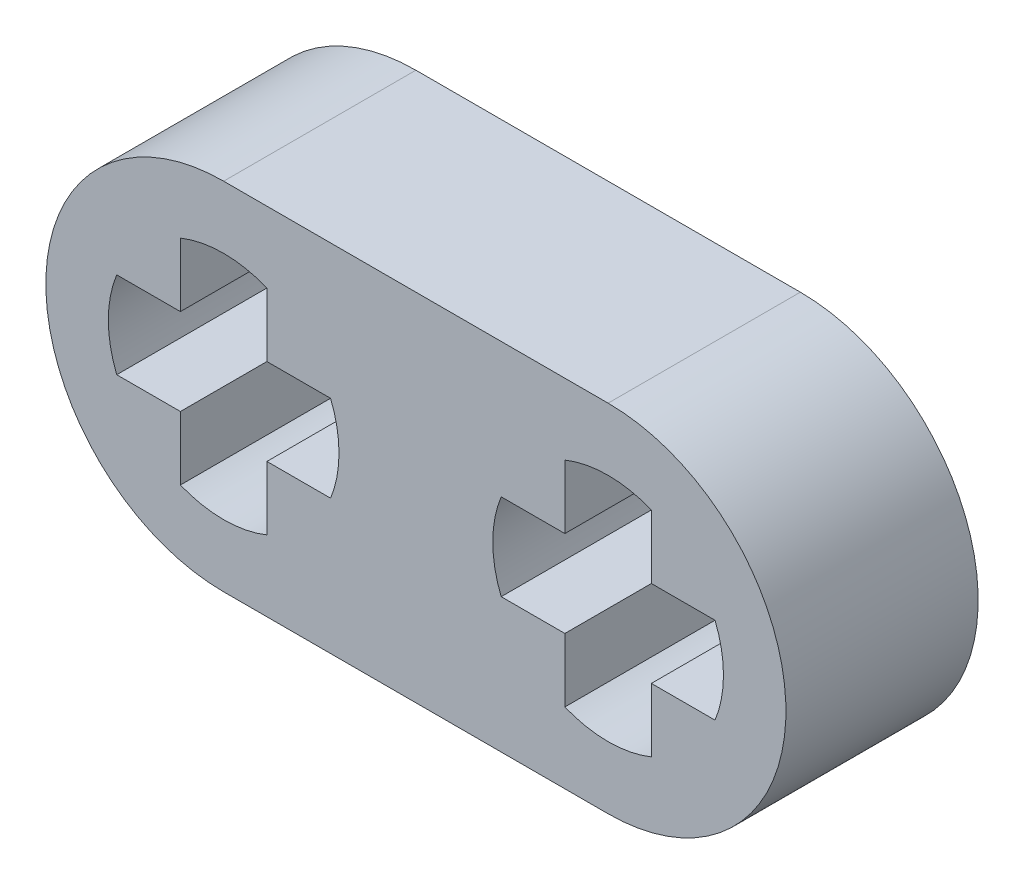
from build123d import *

# Parameters (mm, degrees)
BOSS_EXTRUDE1_DEPTH = 2


with BuildPart() as part:
    # Sketch1 → Boss-Extrude1 (new, symmetric)
    with BuildSketch(Plane.XY):
        with BuildLine():
            Line((-4, -3.7), (4, -3.7))
            ThreePointArc((4, -3.7), (7.7, 0), (4, 3.7))
            Line((4, 3.7), (-4, 3.7))
            ThreePointArc((-4, 3.7), (-7.7, 0), (-4, -3.7))
        make_face()
        with BuildLine():
            Line((-3.1, 2.224859546), (-3.1, 0.9))
            Line((-3.1, 0.9), (-1.775140454, 0.9))
            ThreePointArc((-1.775140454, 0.9), (-1.6, 0), (-1.775140454, -0.9))
            Line((-1.775140454, -0.9), (-3.1, -0.9))
            Line((-3.1, -0.9), (-3.1, -2.224859546))
            ThreePointArc((-3.1, -2.224859546), (-4, -2.4), (-4.9, -2.224859546))
            Line((-4.9, -2.224859546), (-4.9, -0.9))
            Line((-4.9, -0.9), (-6.224859546, -0.9))
            ThreePointArc((-6.224859546, -0.9), (-6.4, 0), (-6.224859546, 0.9))
            Line((-6.224859546, 0.9), (-4.9, 0.9))
            Line((-4.9, 0.9), (-4.9, 2.224859546))
            ThreePointArc((-4.9, 2.224859546), (-4, 2.4), (-3.1, 2.224859546))
        make_face(mode=Mode.SUBTRACT)
        with BuildLine():
            ThreePointArc((4.9, -2.224859546), (4, -2.4), (3.1, -2.224859546))
            Line((3.1, -2.224859546), (3.1, -0.9))
            Line((3.1, -0.9), (1.775140454, -0.9))
            ThreePointArc((1.775140454, -0.9), (1.6, 0), (1.775140454, 0.9))
            Line((1.775140454, 0.9), (3.1, 0.9))
            Line((3.1, 0.9), (3.1, 2.224859546))
            ThreePointArc((3.1, 2.224859546), (4, 2.4), (4.9, 2.224859546))
            Line((4.9, 2.224859546), (4.9, 0.9))
            Line((4.9, 0.9), (6.224859546, 0.9))
            ThreePointArc((6.224859546, 0.9), (6.4, 0), (6.224859546, -0.9))
            Line((6.224859546, -0.9), (4.9, -0.9))
            Line((4.9, -0.9), (4.9, -2.224859546))
        make_face(mode=Mode.SUBTRACT)
    extrude(amount=BOSS_EXTRUDE1_DEPTH, both=True)


solid = part.part
